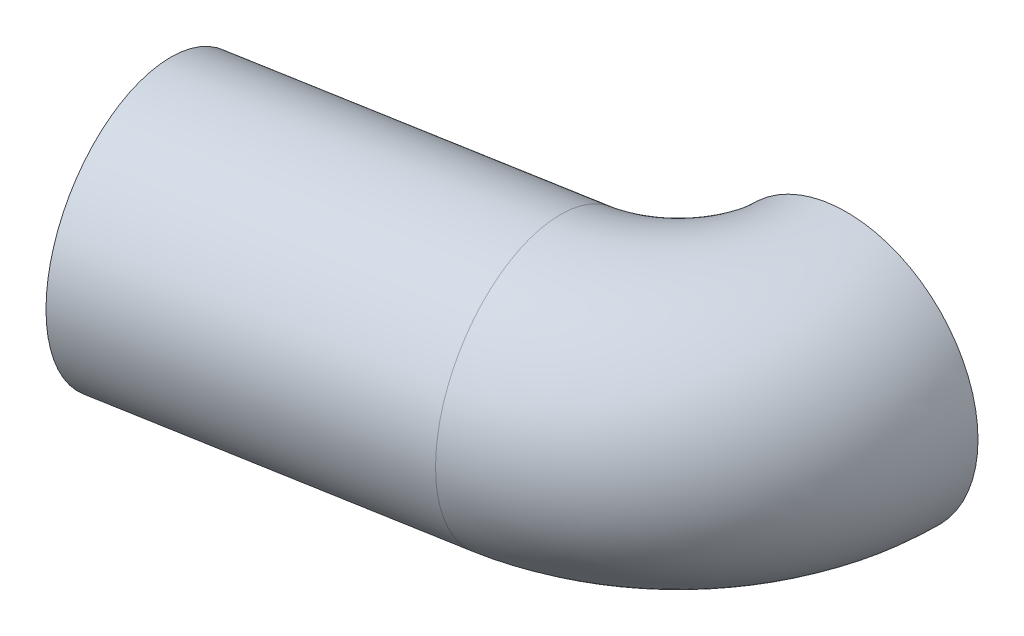
from build123d import *

# Parameters (mm, degrees)
ESQUISSE1_R        = 25
ESQUISSE1_R_2      = 22.5
R_VOLUTION2_ANGLE  = 80
ESQUISSE2_R        = 25
ESQUISSE2_R_2      = 22.5
BOSS_EXTRU_1_DEPTH = 64


with BuildPart() as part:
    # Esquisse1 → Révolution2 (revolve)
    with BuildSketch(Plane.XY):
        Circle(ESQUISSE1_R)
        Circle(ESQUISSE1_R_2, mode=Mode.SUBTRACT)
    revolve(axis=Axis((-32, 38.338668819, 0), (0, -1, 0)), revolution_arc=R_VOLUTION2_ANGLE)

    # Esquisse2 → Boss.-Extru.1 (add)
    with BuildSketch(Plane(origin=(-31.035081933, 0, 5.472322293), x_dir=(0.17364817766692736, 0, 0.9848077530122086), z_dir=(-0.9848077530122086, 0, 0.17364817766692736))):
        with Locations((26.443258315, 0)):
            Circle(ESQUISSE2_R)
        with Locations((26.443258315, 0)):
            Circle(ESQUISSE2_R_2, mode=Mode.SUBTRACT)
    extrude(amount=BOSS_EXTRU_1_DEPTH)


solid = part.part
